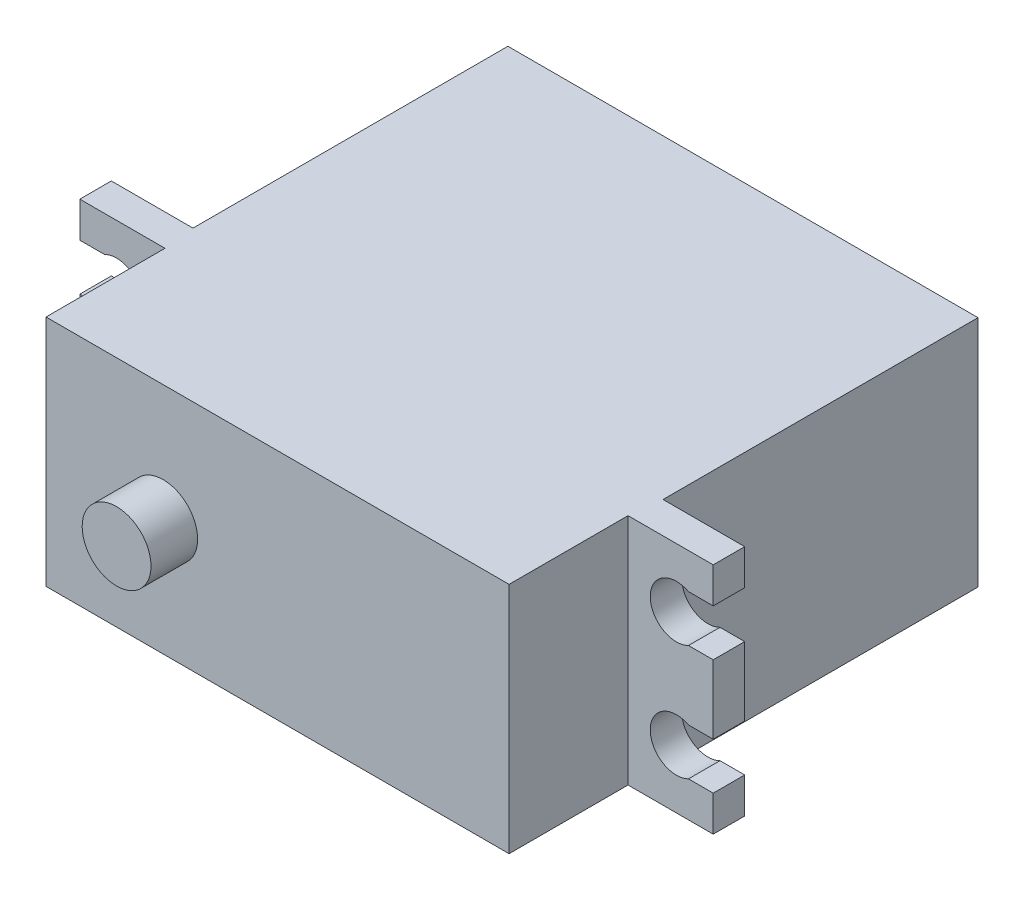
from build123d import *

# Parameters (mm, degrees)
SKETCH1_W           = 40.3
SKETCH1_H           = 27
BOSS_EXTRUDE1_DEPTH = 20
SKETCH2_W           = 40.3
SKETCH2_H           = 5.05
SKETCH2_H_2         = 9.9
BOSS_EXTRUDE2_DEPTH = 2.7
SKETCH3_W           = 39.7
SKETCH3_H           = 20
BOSS_EXTRUDE3_DEPTH = 10.2
BOSS_EXTRUDE4_DEPTH = 4
SKETCH5_W           = 3.501362038
SKETCH5_H           = 11.379426624
BOSS_EXTRUDE5_DEPTH = 4


with BuildPart() as part:
    # Sketch1 → Boss-Extrude1 (new body)
    with BuildSketch(Plane(origin=(0, 0, 0), x_dir=(1, 0, 0), z_dir=(0, 1, 0))):
        Rectangle(SKETCH1_W, SKETCH1_H)
    extrude(amount=BOSS_EXTRUDE1_DEPTH)

    # Sketch2 → Boss-Extrude2 (add)
    with BuildSketch(Plane.XY.offset(13.5)):
        with Locations((0, 2.525)):
            Rectangle(SKETCH2_W, SKETCH2_H)
        with BuildLine():
            Line((-20.15, 0), (-20.15, 5.05))
            Line((-20.15, 5.05), (-21.75, 5.05))
            ThreePointArc((-21.75, 5.05), (-22.82883539, 3.12883539), (-25.030776406, 3.05))
            Line((-25.030776406, 3.05), (-27.15, 3.05))
            Line((-27.15, 3.05), (-27.15, 0))
            Line((-27.15, 0), (-20.15, 0))
        make_face()
        with Locations((0, 10)):
            Rectangle(SKETCH2_W, SKETCH2_H_2)
        with BuildLine():
            Line((-20.15, 5.05), (-20.15, 14.95))
            Line((-20.15, 14.95), (-21.75, 14.95))
            ThreePointArc((-21.75, 14.95), (-22.409009742, 13.359009742), (-24, 12.7))
            Line((-24, 12.7), (-24, 7.3))
            ThreePointArc((-24, 7.3), (-22.409009742, 6.640990258), (-21.75, 5.05))
            Line((-21.75, 5.05), (-20.15, 5.05))
        make_face()
        with BuildLine():
            Line((-25.030776406, 12.95), (-27.15, 12.95))
            Line((-27.15, 12.95), (-27.15, 7.05))
            Line((-27.15, 7.05), (-25.030776406, 7.05))
            ThreePointArc((-25.030776406, 7.05), (-24.530330086, 7.236606961), (-24, 7.3))
            Line((-24, 7.3), (-24, 12.7))
            ThreePointArc((-24, 12.7), (-24.530330086, 12.763393039), (-25.030776406, 12.95))
        make_face()
        with Locations((0, 17.475)):
            Rectangle(SKETCH2_W, SKETCH2_H)
        with BuildLine():
            Line((-20.15, 14.95), (-20.15, 20))
            Line((-20.15, 20), (-27.15, 20))
            Line((-27.15, 20), (-27.15, 16.95))
            Line((-27.15, 16.95), (-25.030776406, 16.95))
            ThreePointArc((-25.030776406, 16.95), (-22.82883539, 16.87116461), (-21.75, 14.95))
            Line((-21.75, 14.95), (-20.15, 14.95))
        make_face()
        with BuildLine():
            Line((27.15, 20), (20.15, 20))
            Line((20.15, 20), (20.15, 14.95))
            Line((20.15, 14.95), (21.75, 14.95))
            ThreePointArc((21.75, 14.95), (22.82883539, 16.87116461), (25.030776406, 16.95))
            Line((25.030776406, 16.95), (27.15, 16.95))
            Line((27.15, 16.95), (27.15, 20))
        make_face()
        with BuildLine():
            Line((27.15, 7.05), (27.15, 12.95))
            Line((27.15, 12.95), (25.030776406, 12.95))
            ThreePointArc((25.030776406, 12.95), (24.530330086, 12.763393039), (24, 12.7))
            Line((24, 12.7), (24, 7.3))
            ThreePointArc((24, 7.3), (24.530330086, 7.236606961), (25.030776406, 7.05))
            Line((25.030776406, 7.05), (27.15, 7.05))
        make_face()
        with BuildLine():
            Line((21.75, 5.05), (20.15, 5.05))
            Line((20.15, 5.05), (20.15, 0))
            Line((20.15, 0), (27.15, 0))
            Line((27.15, 0), (27.15, 3.05))
            Line((27.15, 3.05), (25.030776406, 3.05))
            ThreePointArc((25.030776406, 3.05), (22.82883539, 3.12883539), (21.75, 5.05))
        make_face()
        with BuildLine():
            Line((21.75, 14.95), (20.15, 14.95))
            Line((20.15, 14.95), (20.15, 5.05))
            Line((20.15, 5.05), (21.75, 5.05))
            ThreePointArc((21.75, 5.05), (22.409009742, 6.640990258), (24, 7.3))
            Line((24, 7.3), (24, 12.7))
            ThreePointArc((24, 12.7), (22.409009742, 13.359009742), (21.75, 14.95))
        make_face()
    extrude(amount=BOSS_EXTRUDE2_DEPTH)

    # Sketch3 → Boss-Extrude3 (add)
    with BuildSketch(Plane.XY.offset(16.2)):
        with Locations((0, 10)):
            Rectangle(SKETCH3_W, SKETCH3_H)
    extrude(amount=BOSS_EXTRUDE3_DEPTH)

    # Sketch4 → Boss-Extrude4 (add)
    with BuildSketch(Plane.XY.offset(26.4)):
        with BuildLine():
            ThreePointArc((-6.85, 10), (-9.8, 12.95), (-12.75, 10))
            Line((-12.75, 10), (-6.85, 10))
        make_face()
        with BuildLine():
            Line((-6.85, 10), (-12.75, 10))
            ThreePointArc((-12.75, 10), (-9.8, 7.05), (-6.85, 10))
        make_face()
    extrude(amount=BOSS_EXTRUDE4_DEPTH)

    # Sketch5 → Boss-Extrude5 (add)
    with BuildSketch(Plane.ZY.offset(20.15)):
        with Locations((-8.667769888, 10)):
            Rectangle(SKETCH5_W, SKETCH5_H)
    extrude(amount=BOSS_EXTRUDE5_DEPTH)


solid = part.part
